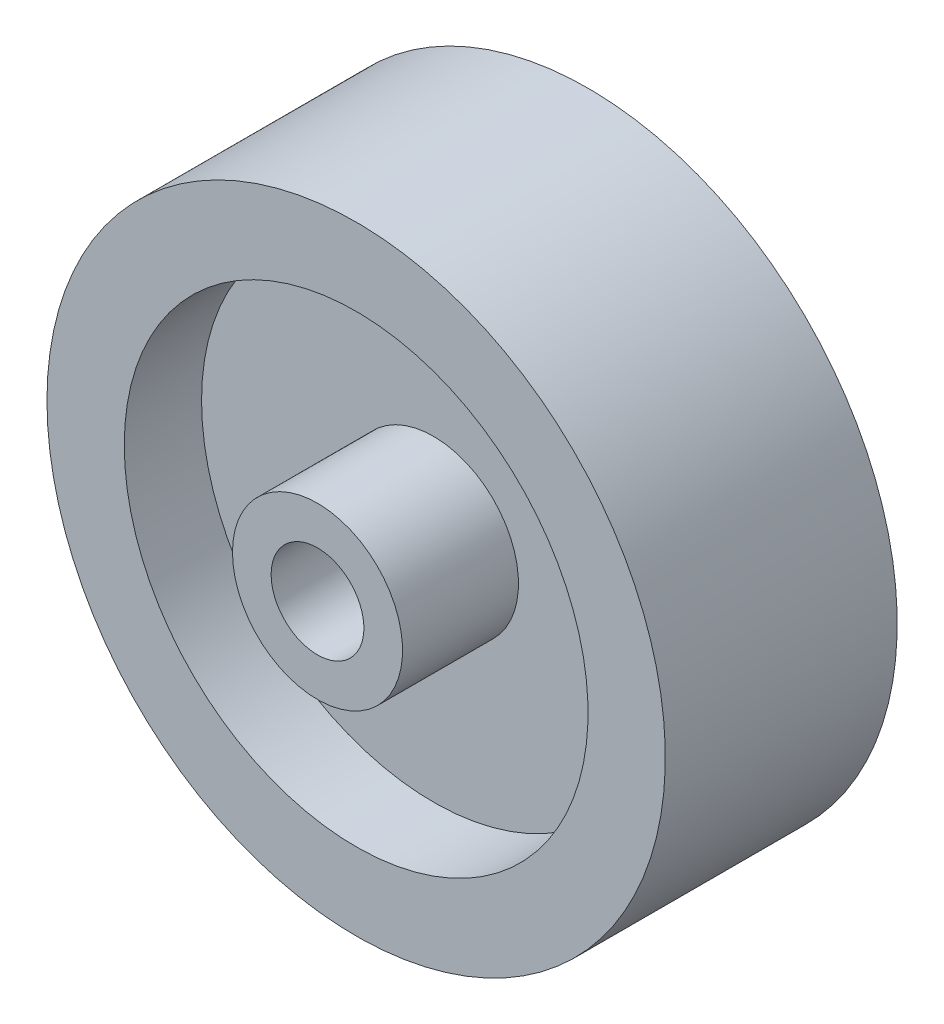
from build123d import *


with BuildPart() as part:
    # Эскиз1 → Повернуть1 (revolve)
    with BuildSketch(Plane(origin=(0, 0, 0), x_dir=(1, 0, 0), z_dir=(0, 1, 0))):
        Polygon((-6, -20), (-6, 20), (-11, 20), (-11, 5), (-30, 5), (-30, 15), (-40, 15), (-40, -15), (-30, -15), (-30, -5), (-11, -5), (-11, -20), align=None)
    revolve(axis=Axis((0, 0, -39.620302307), (0, 0, 1)))


solid = part.part
